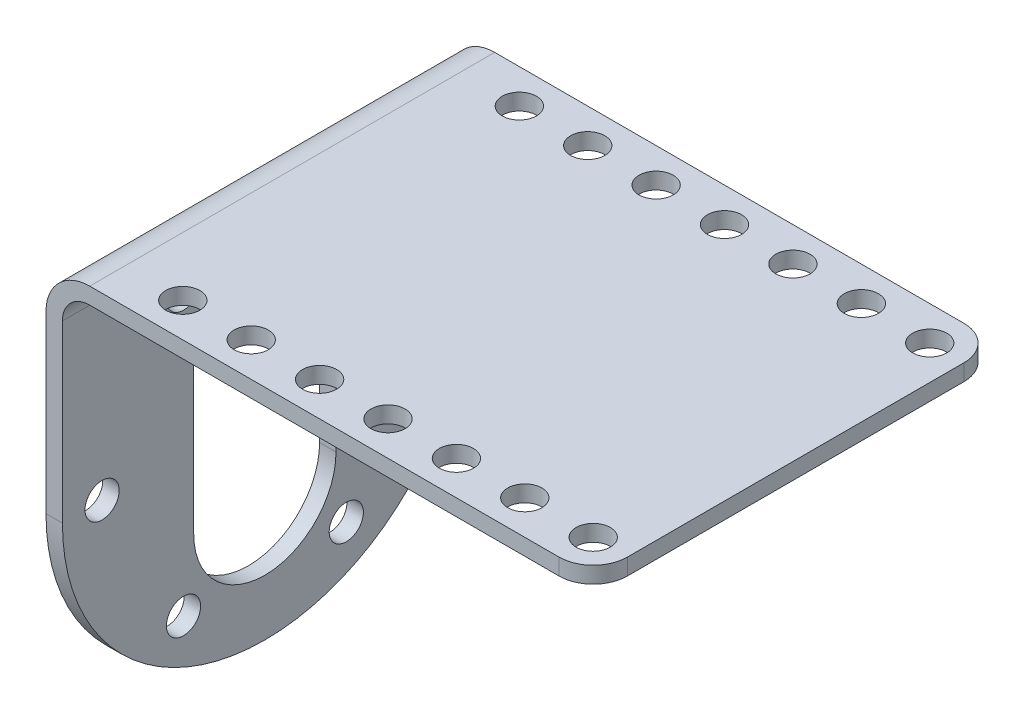
from build123d import *

# Parameters (mm, degrees)
BOSS_EXTRUDE1_DEPTH          = 18.796
CUT_EXTRUDE1_DEPTH           = 67.813105541
CUT_EXTRUDE2_DEPTH           = 67.813105541
F_1_8_0_125_DIAMETER_HOLE2_D = 3.175
FILLET1_R                    = 3.175
F_1_8_0_125_DIAMETER_HOLE1_D = 3.175
LPATTERN1_COUNT              = 7
LPATTERN1_PITCH              = 6.35
MIRROR1_COPY_1_D             = 3.175
MIRROR1_COPY_2_D             = 3.175
MIRROR1_COPY_3_D             = 3.175
MIRROR1_COPY_4_D             = 3.175
MIRROR1_COPY_5_D             = 3.175
MIRROR1_COPY_6_D             = 3.175


with BuildPart() as part:
    # Sketch1 → Boss-Extrude1 (new, symmetric)
    with BuildSketch(Plane.XY):
        with BuildLine():
            Line((0, 0), (0, 35.052))
            ThreePointArc((0, 35.052), (1.190318041, 37.925681959), (4.064, 39.116))
            Line((4.064, 39.116), (50.8, 39.116))
            Line((50.8, 39.116), (50.8, 37.592))
            Line((50.8, 37.592), (4.064, 37.592))
            ThreePointArc((4.064, 37.592), (2.267948776, 36.848051224), (1.524, 35.052))
            Line((1.524, 35.052), (1.524, 0))
            Line((1.524, 0), (0, 0))
        make_face()
    extrude(amount=BOSS_EXTRUDE1_DEPTH, both=True)

    # Sketch2 → Cut-Extrude1 (cut, through all)
    with BuildSketch(Plane.ZY):
        with BuildLine():
            ThreePointArc((0, 0), (-13.290779059, 5.505220941), (-18.796, 18.796))
            Line((-18.796, 18.796), (-18.796, 0))
            Line((-18.796, 0), (0, 0))
        make_face()
        with BuildLine():
            ThreePointArc((18.796, 18.796), (13.290779059, 5.505220941), (0, 0))
            Line((0, 0), (18.796, 0))
            Line((18.796, 0), (18.796, 18.796))
        make_face()
    extrude(amount=-CUT_EXTRUDE1_DEPTH, mode=Mode.SUBTRACT)

    # Sketch3 → Cut-Extrude2 (cut, through all)
    with BuildSketch(Plane.ZY):
        with BuildLine():
            Line((-6.604, 11.811), (-6.604, 25.781))
            ThreePointArc((-6.604, 25.781), (0, 32.385), (6.604, 25.781))
            Line((6.604, 25.781), (6.604, 11.811))
            ThreePointArc((6.604, 11.811), (0, 5.207), (-6.604, 11.811))
        make_face()
    extrude(amount=-CUT_EXTRUDE2_DEPTH, mode=Mode.SUBTRACT)

    # 1/8 (0.125) Diameter Hole2 (through all)
    with Locations(Plane(origin=(0, 31.884241927, -7.5565), x_dir=(0, 0, -1), z_dir=(-1, 0, 0))):
        with Locations((0, 0), (-15.113, 0), (-22.6695, 13.088241927), (-15.113, 26.176483854), (0, 26.176483854), (7.5565, 13.088241927)):
            Hole(F_1_8_0_125_DIAMETER_HOLE2_D / 2)

    # Fillet1
    fillet1_edges = [part.edges().sort_by_distance(p)[0] for p in [
        (50.8, 38.354, 18.796),
        (50.8, 38.354, -18.796),
    ]]
    fillet(fillet1_edges, radius=FILLET1_R)

    # 1/8 (0.125) Diameter Hole1 (through all)
    with Locations(Plane(origin=(47.625, 39.116, -15.621), x_dir=(0, 0, 1), z_dir=(0, 1, 0))):
        with Locations((0, 0)):
            f_1_8_0_125_diameter_hole1 = Hole(F_1_8_0_125_DIAMETER_HOLE1_D / 2)

    # LPattern1: 1/8 (0.125) Diameter Hole1 ×7
    with Locations(*[(-i * LPATTERN1_PITCH, 0, 0) for i in range(1, LPATTERN1_COUNT)]):
        add(f_1_8_0_125_diameter_hole1, mode=Mode.SUBTRACT)

    # Mirror1: 1/8 (0.125) Diameter Hole1 across plane
    add(f_1_8_0_125_diameter_hole1.mirror(Plane.XY), mode=Mode.SUBTRACT)

    # Mirror1 copy 1 (through all)
    with Locations(Plane(origin=(41.275, 39.116, 15.621), x_dir=(0, 0, -1), z_dir=(0, 1, 0))):
        with Locations((0, 0)):
            Hole(MIRROR1_COPY_1_D / 2)

    # Mirror1 copy 2 (through all)
    with Locations(Plane(origin=(34.925, 39.116, 15.621), x_dir=(0, 0, -1), z_dir=(0, 1, 0))):
        with Locations((0, 0)):
            Hole(MIRROR1_COPY_2_D / 2)

    # Mirror1 copy 3 (through all)
    with Locations(Plane(origin=(28.575, 39.116, 15.621), x_dir=(0, 0, -1), z_dir=(0, 1, 0))):
        with Locations((0, 0)):
            Hole(MIRROR1_COPY_3_D / 2)

    # Mirror1 copy 4 (through all)
    with Locations(Plane(origin=(22.225, 39.116, 15.621), x_dir=(0, 0, -1), z_dir=(0, 1, 0))):
        with Locations((0, 0)):
            Hole(MIRROR1_COPY_4_D / 2)

    # Mirror1 copy 5 (through all)
    with Locations(Plane(origin=(15.875, 39.116, 15.621), x_dir=(0, 0, -1), z_dir=(0, 1, 0))):
        with Locations((0, 0)):
            Hole(MIRROR1_COPY_5_D / 2)

    # Mirror1 copy 6 (through all)
    with Locations(Plane(origin=(9.525, 39.116, 15.621), x_dir=(0, 0, -1), z_dir=(0, 1, 0))):
        with Locations((0, 0)):
            Hole(MIRROR1_COPY_6_D / 2)


solid = part.part
